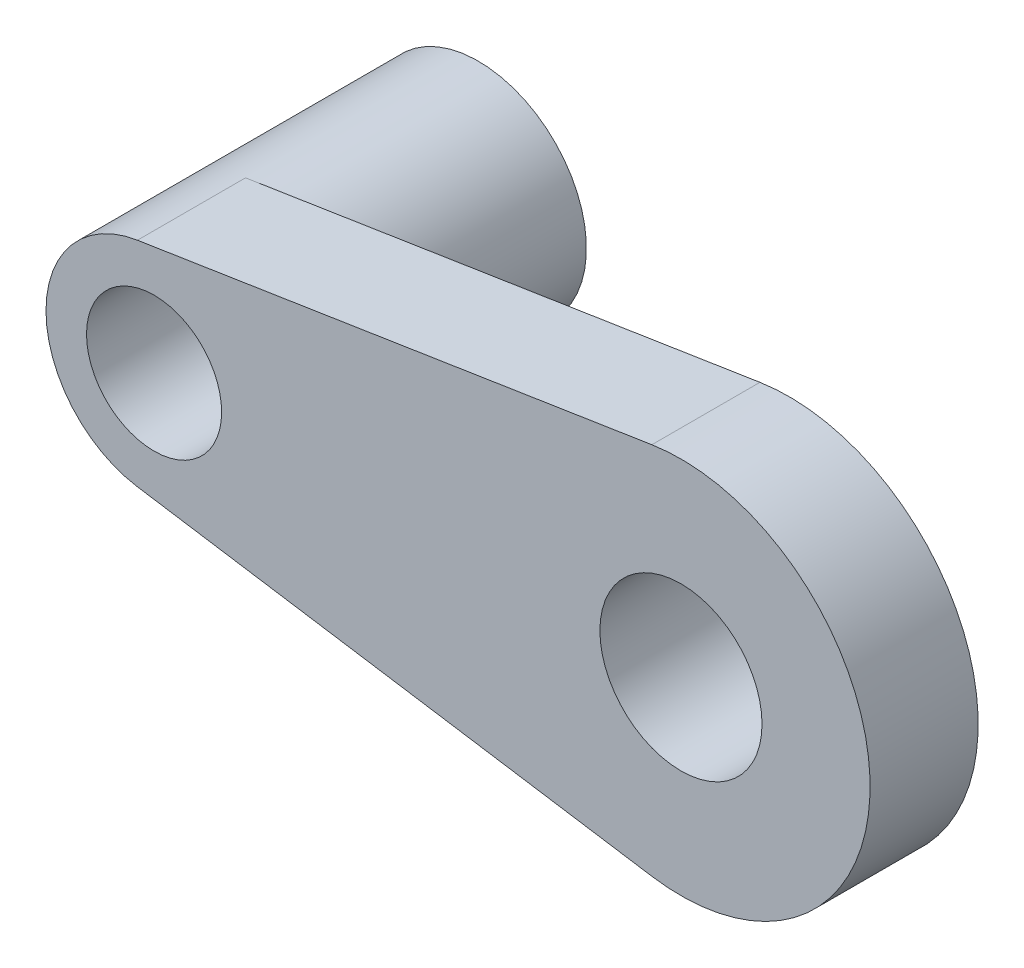
from build123d import *
from build123d.topology import SkipClean

# Parameters (mm, degrees)
ESQUISSE1_R        = 1.5
ESQUISSE1_R_2      = 1.25
BOSS_EXTRU_1_DEPTH = 2
BOSS_EXTRU_2_START = 4
ESQUISSE2_R        = 2
ESQUISSE2_R_2      = 1.25
BOSS_EXTRU_2_DEPTH = 4
BOSS_EXTRU_3_START = 0.5
ESQUISSE3_R        = 1.75
ESQUISSE3_R_2      = 1.5
BOSS_EXTRU_3_DEPTH = 0.5


with BuildPart() as part:
    # Esquisse1 → Boss.-Extru.1 (new body)
    with BuildSketch(Plane.XY):
        with BuildLine():
            Line((-10.057692308, 1.976189627), (-0.538461538, 3.458331848))
            ThreePointArc((-0.538461538, 3.458331848), (3.5, 0), (-0.538461538, -3.458331848))
            Line((-0.538461538, -3.458331848), (-10.057692308, -1.976189627))
            ThreePointArc((-10.057692308, -1.976189627), (-11.75, 0), (-10.057692308, 1.976189627))
        make_face()
        Circle(ESQUISSE1_R, mode=Mode.SUBTRACT)
        with Locations((-9.75, 0)):
            Circle(ESQUISSE1_R_2, mode=Mode.SUBTRACT)
    extrude(amount=BOSS_EXTRU_1_DEPTH)

    # Esquisse2 → Boss.-Extru.2 (add)
    with SkipClean():  # the faces are left unmerged after this step: merging them gives an invalid solid
        with BuildSketch(Plane(origin=(0, 0, 0), x_dir=(-1, 0, 0), z_dir=(0, 0, -1)).offset(BOSS_EXTRU_2_START)):
            with Locations((9.75, 0)):
                Circle(ESQUISSE2_R)
            with Locations((9.75, 0)):
                Circle(ESQUISSE2_R_2, mode=Mode.SUBTRACT)
        extrude(amount=-BOSS_EXTRU_2_DEPTH)

    # Esquisse3 → Boss.-Extru.3 (add)
    with SkipClean():  # the faces are left unmerged after this step: merging them gives an invalid solid
        with BuildSketch(Plane(origin=(0, 0, 0), x_dir=(-1, 0, 0), z_dir=(0, 0, -1)).offset(BOSS_EXTRU_3_START)):
            with Locations(Location((0, 0, 0), (0, 0, 180))):
                Circle(ESQUISSE3_R)
            Circle(ESQUISSE3_R_2, mode=Mode.SUBTRACT)
        extrude(amount=-BOSS_EXTRU_3_DEPTH)


solid = part.part
